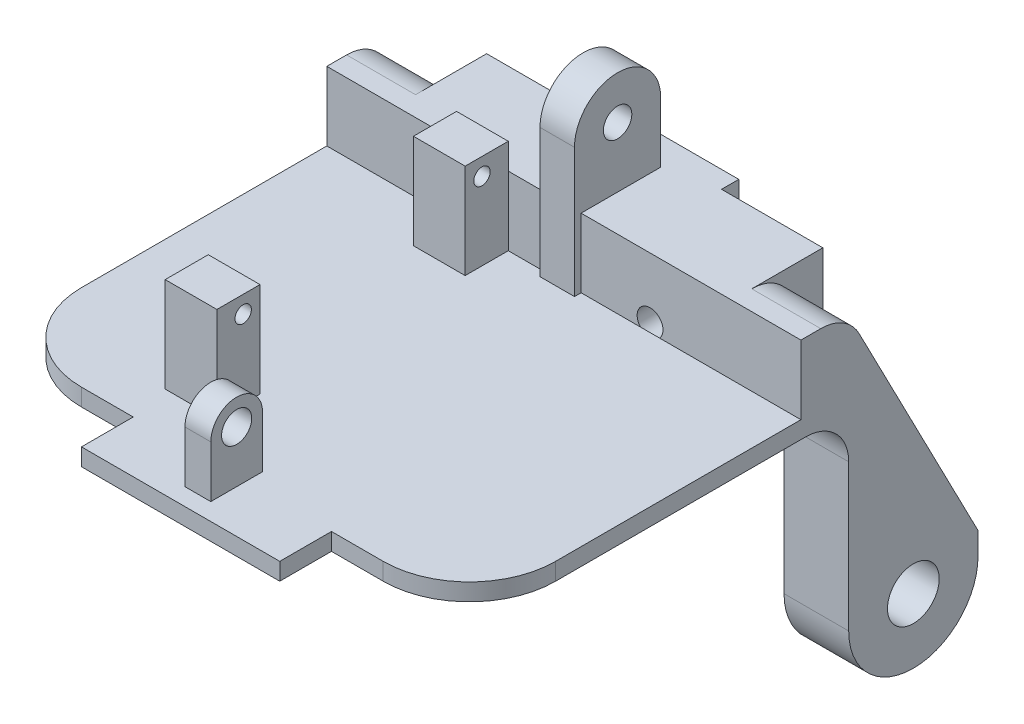
from build123d import *

# Parameters (mm, degrees)
SKETCH_1_W          = 55
SKETCH_1_H          = 39
EXTRUDE_1_DEPTH     = 2
SKETCH_2_W          = 23
SKETCH_2_H          = 6
EXTRUDE_2_DEPTH     = 2
SKETCH_3_W          = 6
SKETCH_3_H          = 5
EXTRUDE_3_DEPTH     = 11
SKETCH_5_R          = 0.95
CUT_EXTRUDE_1_DEPTH = 11
SKETCH_6_W          = 55
SKETCH_6_H          = 0.541458129
EXTRUDE_4_DEPTH     = 8
SKETCH_8_R          = 1.65
EXTRUDE_6_DEPTH     = 2
SKETCH_10_W         = 3
SKETCH_10_H         = 6
EXTRUDE_7_DEPTH     = 9
SKETCH_11_R         = 1.5
CUT_EXTRUDE_3_DEPTH = 13
SKETCH_12_R         = 3
EXTRUDE_8_DEPTH     = 7.5
SKETCH_13_W         = 10
SKETCH_13_H         = 3.7
EXTRUDE_9_DEPTH     = 1
FILLET_3_RADIUS     = 3
FILLET_3_LENGTH     = 3
SKETCH_15_R         = 1.75
CUT_EXTRUDE_5_DEPTH = 23
SKETCH_16_W         = 15.5
SKETCH_16_H         = 4
EXTRUDE_10_DEPTH    = 20
SKETCH_17_R         = 1.5
EXTRUDE_11_DEPTH    = 10
FILLET_4_R          = 10
SKETCH_18_W         = 26.564734734
SKETCH_18_H         = 10.454508508
CUT_EXTRUDE_6_DEPTH = 10
CUT_EXTRUDE_7_DEPTH = 8
CUT_EXTRUDE_8_DEPTH = 8
FILLET_6_R          = 5
SKETCH_21_R         = 1.4
CUT_EXTRUDE_9_DEPTH = 4
FILLET_7_R          = 10


with BuildPart() as part:
    # 草图1 → 凸台-拉伸1 (new body)
    with BuildSketch(Plane(origin=(0, 0, 0), x_dir=(1, 0, 0), z_dir=(0, 1, 0))):
        Rectangle(SKETCH_1_W, SKETCH_1_H)
    extrude(amount=EXTRUDE_1_DEPTH)

    # 草图2 → 凸台-拉伸2 (add)
    with BuildSketch(Plane(origin=(0, 2, 0), x_dir=(1, 0, 0), z_dir=(0, 1, 0))):
        with Locations((0, -22.5)):
            Rectangle(SKETCH_2_W, SKETCH_2_H)
    extrude(amount=-EXTRUDE_2_DEPTH)

    # 草图3 → 凸台-拉伸3 (add)
    with BuildSketch(Plane(origin=(0, 2, 0), x_dir=(1, 0, 0), z_dir=(0, 1, 0))):
        with Locations((-9.45, -12.341458129)):
            Rectangle(SKETCH_3_W, SKETCH_3_H)
        with Locations((-9.45, 16.458541871)):
            Rectangle(SKETCH_3_W, SKETCH_3_H)
    extrude(amount=EXTRUDE_3_DEPTH)

    # 草图5 → 切除-拉伸1 (cut)
    with BuildSketch(Plane.ZY.offset(12.45)):
        with Locations((-15.908541871, 11)):
            Circle(SKETCH_5_R)
        with Locations((11.791458129, 11)):
            Circle(SKETCH_5_R)
    extrude(amount=-CUT_EXTRUDE_1_DEPTH, mode=Mode.SUBTRACT)

    # 草图6 → 凸台-拉伸4 (add)
    with BuildSketch(Plane(origin=(0, 2, 0), x_dir=(1, 0, 0), z_dir=(0, 1, 0))):
        with Locations((0, 19.229270936)):
            Rectangle(SKETCH_6_W, SKETCH_6_H)
    extrude(amount=EXTRUDE_4_DEPTH)

    # 草图8 → 凸台-拉伸6 (add, symmetric)
    with BuildSketch(Plane(origin=(0, 0, 0), x_dir=(0, 0, -1), z_dir=(1, 0, 0))):
        with BuildLine():
            Line((28.189872998, 17), (28.189872998, 0))
            Line((28.189872998, 0), (18.189872998, 0))
            Line((18.189872998, 0), (18.189872998, 17))
            ThreePointArc((18.189872998, 17), (23.189872998, 22), (28.189872998, 17))
        make_face()
        with Locations((23.189872998, 17)):
            Circle(SKETCH_8_R, mode=Mode.SUBTRACT)
    extrude(amount=EXTRUDE_6_DEPTH, both=True)

    # 草图10 → 凸台-拉伸7 (add)
    with BuildSketch(Plane(origin=(0, 2, 0), x_dir=(1, 0, 0), z_dir=(0, 1, 0))):
        with Locations((0, -20.5)):
            Rectangle(SKETCH_10_W, SKETCH_10_H)
    extrude(amount=EXTRUDE_7_DEPTH)

    # 草图11 → 切除-拉伸3 (cut)
    with BuildSketch(Plane.XY.offset(-18.958541871)):
        with Locations((-10, 3)):
            Circle(SKETCH_11_R)
    cut_extrude_3 = extrude(amount=-CUT_EXTRUDE_3_DEPTH, mode=Mode.SUBTRACT)

    # 草图12 → 凸台-拉伸8 (add)
    with BuildSketch(Plane.ZY.offset(27.5)):
        with BuildLine():
            Line((-39.5, -22), (-39.5, 10))
            Line((-39.5, 10), (-19.5, 10))
            Line((-19.5, 10), (-19.5, 0))
            Line((-19.5, 0), (-24.5, 0))
            Line((-24.5, 0), (-24.5, -22))
            ThreePointArc((-24.5, -22), (-32, -29.5), (-39.5, -22))
        make_face()
        with Locations((-32, -22)):
            Circle(SKETCH_12_R, mode=Mode.SUBTRACT)
    extrude_8 = extrude(amount=-EXTRUDE_8_DEPTH)

    # 草图13 → 凸台-拉伸9 (add)
    with BuildSketch(Plane.XZ):
        with Locations((0, 19.15)):
            Rectangle(SKETCH_13_W, SKETCH_13_H)
    extrude(amount=EXTRUDE_9_DEPTH)

    # 镜向1: 切除-拉伸3, 凸台-拉伸8 across plane
    add(cut_extrude_3.mirror(Plane(origin=(0, 0, 0), x_dir=(0, 0, 1), z_dir=(1, 0, 0))), mode=Mode.SUBTRACT)
    add(extrude_8.mirror(Plane(origin=(0, 0, 0), x_dir=(0, 0, 1), z_dir=(1, 0, 0))))

    # 圆角3: full round fillet: the end face becomes a half cylinder, R = half its width
    fillet_3_face = Plane((0, 11, 20.5), x_dir=(1, 0, 0), z_dir=(0, 1, 0))  # on the end face: x along it, z out of the body
    fillet_3_slab = fillet_3_face.offset(-FILLET_3_RADIUS / 2) * Box(FILLET_3_LENGTH, 2 * FILLET_3_RADIUS, FILLET_3_RADIUS, mode=Mode.PRIVATE)  # the body's end, R deep
    fillet_3_round = Plane((0, 8, 20.5), x_dir=(0, 1, 0), z_dir=(1, 0, 0)) * Cylinder(FILLET_3_RADIUS, FILLET_3_LENGTH, mode=Mode.PRIVATE)  # its axis R under the face
    add(fillet_3_slab - fillet_3_round, mode=Mode.SUBTRACT)

    # 草图15 → 切除-拉伸5 (cut)
    with BuildSketch(Plane.ZY.offset(1.5)):
        with Locations((20.5, 8)):
            Circle(SKETCH_15_R)
    extrude(amount=-CUT_EXTRUDE_5_DEPTH, mode=Mode.SUBTRACT)

    # 草图16 → 凸台-拉伸10 (add)
    with BuildSketch(Plane(origin=(0, 0, -19.5), x_dir=(-1, 0, 0), z_dir=(0, 0, -1))):
        with Locations((0, 8)):
            Rectangle(SKETCH_16_W, SKETCH_16_H)
    extrude(amount=EXTRUDE_10_DEPTH)

    # 草图17 → 凸台-拉伸11 (add)
    # profile 1 of 2: a face of its own
    with BuildSketch(Plane(origin=(0, 0, -19.5), x_dir=(-1, 0, 0), z_dir=(0, 0, -1))):
        Polygon((-20, 0), (-2, 0), (-2, 6), (-7.75, 6), (-7.75, 10), (-20, 10), align=None)
        with Locations(Location((-10, 3, 0), (0, 0, 221.810314896))):
            Circle(SKETCH_17_R, mode=Mode.SUBTRACT)
    # profile 2 of 2: a face of its own
    with BuildSketch(Plane(origin=(0, 0, -19.5), x_dir=(-1, 0, 0), z_dir=(0, 0, -1))):
        Polygon((7.75, 6), (2, 6), (2, 0), (20, 0), (20, 10), (7.75, 10), align=None)
        with Locations(Location((10, 3, 0), (0, 0, 180))):
            Circle(SKETCH_17_R, mode=Mode.SUBTRACT)
    extrude(amount=EXTRUDE_11_DEPTH)

    # 圆角4
    fillet_4_edges = [part.edges().sort_by_distance(p)[0] for p in [
        (23.75, 10, -39.5),
        (-23.75, 10, -39.5),
    ]]
    fillet(fillet_4_edges, radius=FILLET_4_R)

    # 草图18 → 切除-拉伸6 (cut)
    with BuildSketch(Plane(origin=(0, 10, 0), x_dir=(1, 0, 0), z_dir=(0, 1, 0))):
        with Locations((-0.840887807, 36.727254254)):
            Rectangle(SKETCH_18_W, SKETCH_18_H)
    extrude(amount=-CUT_EXTRUDE_6_DEPTH, mode=Mode.SUBTRACT)

    # 草图19 → 切除-拉伸7 (cut)
    with BuildSketch(Plane(origin=(27.5, 0, 0), x_dir=(0, 0, -1), z_dir=(1, 0, 0))):
        Polygon((24.3, 10), (39.5, -19.395601839), (39.5, 10), align=None)
    extrude(amount=-CUT_EXTRUDE_7_DEPTH, mode=Mode.SUBTRACT)

    # 草图20 → 切除-拉伸8 (cut)
    with BuildSketch(Plane.ZY.offset(27.5)):
        Polygon((-24.3, 10), (-39.5, 10), (-39.5, -19.395601839), align=None)
    extrude(amount=-CUT_EXTRUDE_8_DEPTH, mode=Mode.SUBTRACT)

    # 圆角6
    fillet_6_edges = [part.edges().sort_by_distance(p)[0] for p in [
        (-23.75, 0, -24.5),
        (23.75, 0, -24.5),
        (23.5, 10, -24.3),
        (-23.5, 10, -24.3),
    ]]
    fillet(fillet_6_edges, radius=FILLET_6_R)

    # 草图21 → 切除-拉伸9 (cut)
    with BuildSketch(Plane.XZ.offset(1)):
        with Locations(Location((0, 19, 0), (0, 0, 270))):
            Circle(SKETCH_21_R)
    extrude(amount=-CUT_EXTRUDE_9_DEPTH, mode=Mode.SUBTRACT)

    # 圆角7
    fillet_7_edges = [part.edges().sort_by_distance(p)[0] for p in [
        (27.5, 1, 19.5),
        (-27.5, 1, 19.5),
    ]]
    fillet(fillet_7_edges, radius=FILLET_7_R)


solid = part.part
